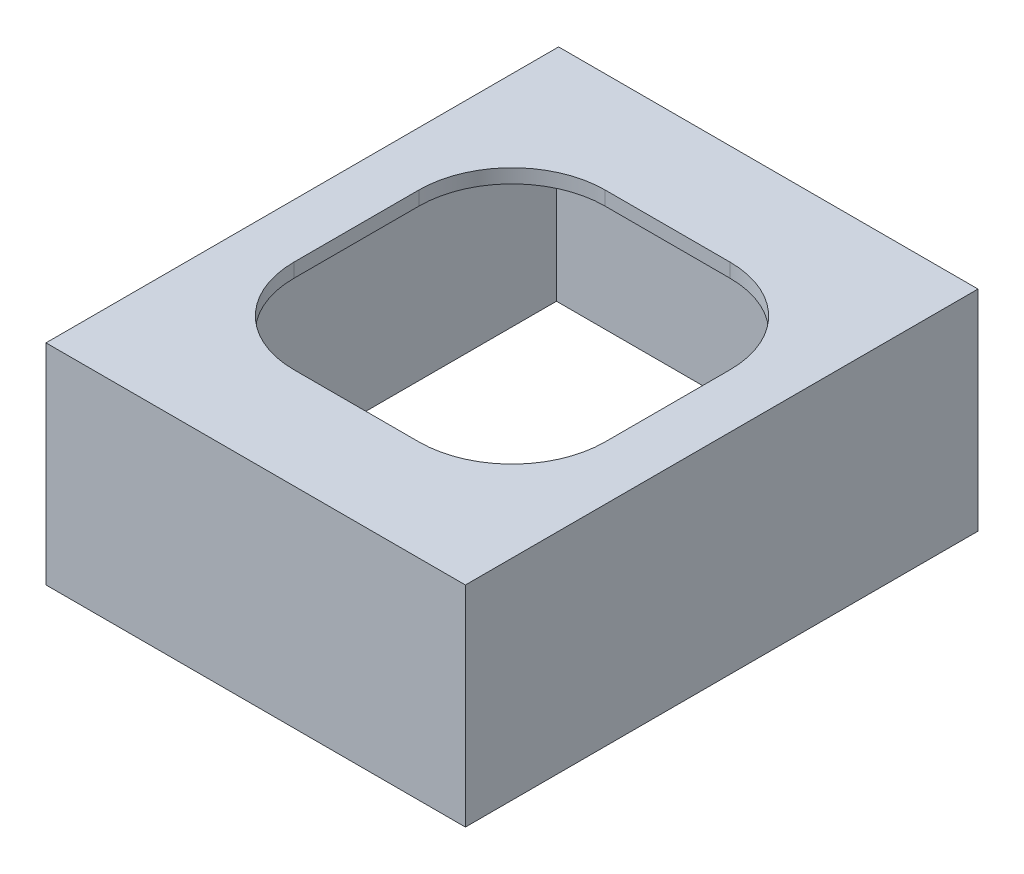
from build123d import *

# Parameters (mm, degrees)
SKETCH1_W           = 90
SKETCH1_H           = 110
BOSS_EXTRUDE1_DEPTH = 3
CUT_EXTRUDE5_DEPTH  = 72.126647608
SKETCH3_W           = 90
SKETCH3_H           = 110
SKETCH3_W_2         = 85.90909091
SKETCH3_H_2         = 105
BOSS_EXTRUDE2_DEPTH = 42


with BuildPart() as part:
    # Sketch1 → Boss-Extrude1 (new body)
    with BuildSketch(Plane(origin=(0, 12.45, 0), x_dir=(1, 0, 0), z_dir=(0, 1, 0))):
        Rectangle(SKETCH1_W, SKETCH1_H)
    extrude(amount=-BOSS_EXTRUDE1_DEPTH)

    # Sketch2 → Cut-Extrude5 (cut, through all)
    with BuildSketch(Plane(origin=(0, 12.45, 0), x_dir=(1, 0, 0), z_dir=(0, 1, 0))):
        with BuildLine():
            Line((-13.4, 33.399999142), (13.4, 33.399999142))
            ThreePointArc((13.4, 33.399999142), (27.542135624, 27.542134765), (33.4, 13.399999142))
            Line((33.4, 13.399999142), (33.4, -13.399999142))
            ThreePointArc((33.4, -13.399999142), (27.542135624, -27.542134765), (13.4, -33.399999142))
            Line((13.4, -33.399999142), (-13.4, -33.399999142))
            ThreePointArc((-13.4, -33.399999142), (-27.542135624, -27.542134765), (-33.4, -13.399999142))
            Line((-33.4, -13.399999142), (-33.4, 13.399999142))
            ThreePointArc((-33.4, 13.399999142), (-27.542135624, 27.542134765), (-13.4, 33.399999142))
        make_face()
    extrude(amount=-CUT_EXTRUDE5_DEPTH, mode=Mode.SUBTRACT)

    # Sketch3 → Boss-Extrude2 (add)
    with BuildSketch(Plane.XZ.offset(-9.45)):
        Rectangle(SKETCH3_W, SKETCH3_H)
        Rectangle(SKETCH3_W_2, SKETCH3_H_2, mode=Mode.SUBTRACT)
    extrude(amount=BOSS_EXTRUDE2_DEPTH)


solid = part.part
